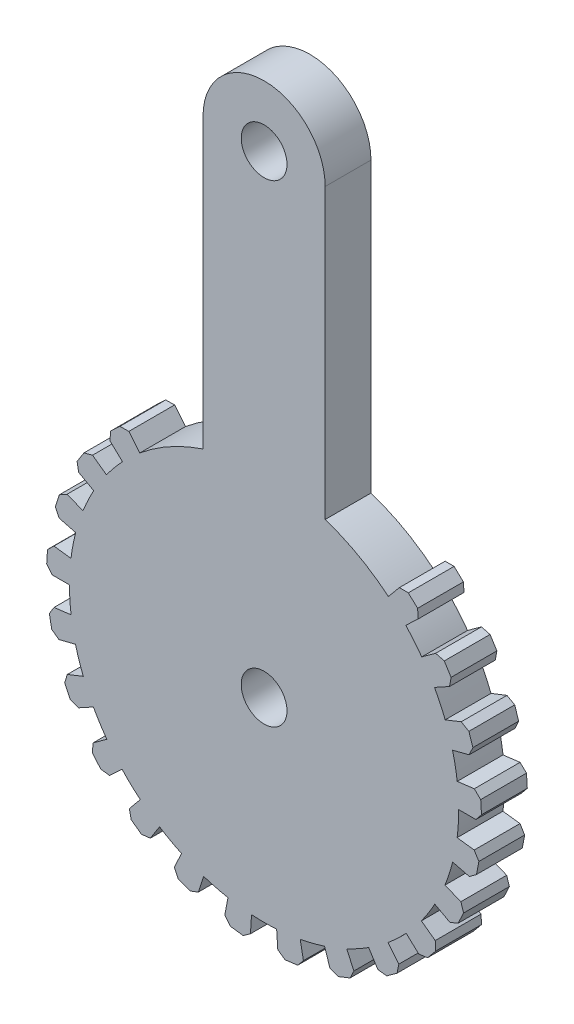
from build123d import *

# Parameters (mm, degrees)
SKETCH1_R           = 1.5
BOSS_EXTRUDE2_DEPTH = 3


with BuildPart() as part:
    # Sketch1 → Boss-Extrude2 (new body)
    with BuildSketch(Plane.XY):
        with BuildLine():
            Line((-4, 31), (-4, 12.106300013))
            ThreePointArc((-4, 12.106300013), (-4.733275563, 11.838859846), (-5.448812758, 11.527052508))
            ThreePointArc((-5.448812758, 11.527052508), (-6.142359345, 11.172910171), (-6.812992455, 10.777088374))
            ThreePointArc((-6.812992455, 10.777088374), (-7.494261967, 10.314966678), (-8.144289673, 9.809844327))
            Line((-8.144289673, 9.809844327), (-8.862903468, 10.675418826))
            Line((-8.862903468, 10.675418826), (-9.445525531, 10.669796035))
            Line((-9.445525531, 10.669796035), (-10.055652175, 10.096848981))
            Line((-10.055652175, 10.096848981), (-10.097847012, 9.515729647))
            Line((-10.097847012, 9.515729647), (-9.27910266, 8.744184))
            ThreePointArc((-9.27910266, 8.744184), (-9.824043845, 8.127155869), (-10.328030916, 7.476247548))
            Line((-10.328030916, 7.476247548), (-11.239327761, 8.13591645))
            Line((-11.239327761, 8.13591645), (-11.80224735, 7.985578094))
            Line((-11.80224735, 7.985578094), (-12.250719604, 7.278898898))
            Line((-12.250719604, 7.278898898), (-12.147070312, 6.705543068))
            Line((-12.147070312, 6.705543068), (-11.162172719, 6.161850387))
            ThreePointArc((-11.162172719, 6.161850387), (-11.536544919, 5.428685967), (-11.862823992, 4.672890641))
            Line((-11.862823992, 4.672890641), (-12.909543756, 5.085204521))
            Line((-12.909543756, 5.085204521), (-13.417390562, 4.799596912))
            Line((-13.417390562, 4.799596912), (-13.676029266, 4.003588828))
            Line((-13.676029266, 4.003588828), (-13.43304851, 3.474022556))
            Line((-13.43304851, 3.474022556), (-12.343882415, 3.192345052))
            ThreePointArc((-12.343882415, 3.192345052), (-12.524162447, 2.389111761), (-12.652232208, 1.575918828))
            Line((-12.652232208, 1.575918828), (-13.768605638, 1.71497049))
            Line((-13.768605638, 1.71497049), (-14.189469779, 1.312039404))
            Line((-14.189469779, 1.312039404), (-14.242023712, 0.476718548))
            Line((-14.242023712, 0.476718548), (-13.874978867, 0.024216431))
            Line((-13.874978867, 0.024216431), (-12.749980581, 0.022252937))
            ThreePointArc((-12.749980581, 0.022252937), (-12.724840787, -0.800579124), (-12.646654143, -1.62007376))
            Line((-12.646654143, -1.62007376), (-13.762535391, -1.763021444))
            Line((-13.762535391, -1.763021444), (-14.069972424, -2.257958364))
            Line((-14.069972424, -2.257958364), (-13.91313943, -3.080105712))
            Line((-13.91313943, -3.080105712), (-13.445093273, -3.427111302))
            Line((-13.445093273, -3.427111302), (-12.354950575, -3.149237412))
            ThreePointArc((-12.354950575, -3.149237412), (-12.125970583, -3.939966678), (-11.846440287, -4.714271155))
            Line((-11.846440287, -4.714271155), (-12.89171443, -5.130236257))
            Line((-12.89171443, -5.130236257), (-13.066406957, -5.686080305))
            Line((-13.066406957, -5.686080305), (-12.710041429, -6.443395602))
            Line((-12.710041429, -6.443395602), (-12.170403021, -6.663101027))
            Line((-12.170403021, -6.663101027), (-11.183613587, -6.122849592))
            ThreePointArc((-11.183613587, -6.122849592), (-10.76518105, -6.831791636), (-10.30187102, -7.512253556))
            Line((-10.30187102, -7.512253556), (-11.210859639, -8.175099458))
            Line((-11.210859639, -8.175099458), (-11.241831085, -8.756924908))
            Line((-11.241831085, -8.756924908), (-10.70832478, -9.401823249))
            Line((-10.70832478, -9.401823249), (-10.131001588, -9.48042361))
            Line((-10.131001588, -9.48042361), (-9.309569027, -8.711740614))
            ThreePointArc((-9.309569027, -8.711740614), (-8.727975601, -9.29435), (-8.109997309, -9.838213438))
            Line((-8.109997309, -9.838213438), (-8.825585306, -10.706291095))
            Line((-8.825585306, -10.706291095), (-8.710889622, -11.277539713))
            Line((-8.710889622, -11.277539713), (-8.033764703, -11.769499764))
            Line((-8.033764703, -11.769499764), (-7.455032066, -11.702056311))
            Line((-7.455032066, -11.702056311), (-6.850570006, -10.753240934))
            ThreePointArc((-6.850570006, -10.753240934), (-6.142359345, -11.172910171), (-5.40854264, -11.546002187))
            Line((-5.40854264, -11.546002187), (-5.885766991, -12.564767086))
            Line((-5.885766991, -12.564767086), (-5.632610928, -13.089545223))
            Line((-5.632610928, -13.089545223), (-4.854413643, -13.397655324))
            Line((-4.854413643, -13.397655324), (-4.310635461, -13.188405776))
            Line((-4.310635461, -13.188405776), (-3.961124478, -12.119075578))
            ThreePointArc((-3.961124478, -12.119075578), (-3.170796061, -12.349435304), (-2.367249346, -12.528313156))
            Line((-2.367249346, -12.528313156), (-2.576124288, -13.633752552))
            Line((-2.576124288, -13.633752552), (-2.200414573, -14.079086466))
            Line((-2.200414573, -14.079086466), (-1.370041921, -14.183986927))
            Line((-1.370041921, -14.183986927), (-0.895385777, -13.846079204))
            Line((-0.895385777, -13.846079204), (-0.82278693, -12.723424133))
            ThreePointArc((-0.82278693, -12.723424133), (0, -12.75), (0.82278693, -12.723424133))
            Line((0.82278693, -12.723424133), (0.895385777, -13.846079204))
            Line((0.895385777, -13.846079204), (1.370041921, -14.183986927))
            Line((1.370041921, -14.183986927), (2.200414573, -14.079086466))
            Line((2.200414573, -14.079086466), (2.576124288, -13.633752552))
            Line((2.576124288, -13.633752552), (2.367249346, -12.528313156))
            ThreePointArc((2.367249346, -12.528313156), (3.170796061, -12.349435304), (3.961124478, -12.119075578))
            Line((3.961124478, -12.119075578), (4.310635461, -13.188405776))
            Line((4.310635461, -13.188405776), (4.854413643, -13.397655324))
            Line((4.854413643, -13.397655324), (5.632610928, -13.089545223))
            Line((5.632610928, -13.089545223), (5.885766991, -12.564767086))
            Line((5.885766991, -12.564767086), (5.40854264, -11.546002187))
            ThreePointArc((5.40854264, -11.546002187), (6.142359345, -11.172910171), (6.850570006, -10.753240934))
            Line((6.850570006, -10.753240934), (7.455032066, -11.702056311))
            Line((7.455032066, -11.702056311), (8.033764703, -11.769499764))
            Line((8.033764703, -11.769499764), (8.710889622, -11.277539713))
            Line((8.710889622, -11.277539713), (8.825585306, -10.706291095))
            Line((8.825585306, -10.706291095), (8.109997309, -9.838213438))
            ThreePointArc((8.109997309, -9.838213438), (8.727975601, -9.29435), (9.309569027, -8.711740614))
            Line((9.309569027, -8.711740614), (10.131001588, -9.48042361))
            Line((10.131001588, -9.48042361), (10.70832478, -9.401823249))
            Line((10.70832478, -9.401823249), (11.241831085, -8.756924908))
            Line((11.241831085, -8.756924908), (11.210859639, -8.175099458))
            Line((11.210859639, -8.175099458), (10.30187102, -7.512253556))
            ThreePointArc((10.30187102, -7.512253556), (10.76518105, -6.831791636), (11.183613587, -6.122849592))
            Line((11.183613587, -6.122849592), (12.170403021, -6.663101027))
            Line((12.170403021, -6.663101027), (12.710041429, -6.443395602))
            Line((12.710041429, -6.443395602), (13.066406957, -5.686080305))
            Line((13.066406957, -5.686080305), (12.89171443, -5.130236257))
            Line((12.89171443, -5.130236257), (11.846440287, -4.714271155))
            ThreePointArc((11.846440287, -4.714271155), (12.125970583, -3.939966678), (12.354950575, -3.149237412))
            Line((12.354950575, -3.149237412), (13.445093273, -3.427111302))
            Line((13.445093273, -3.427111302), (13.91313943, -3.080105712))
            Line((13.91313943, -3.080105712), (14.069972424, -2.257958364))
            Line((14.069972424, -2.257958364), (13.762535391, -1.763021444))
            Line((13.762535391, -1.763021444), (12.646654143, -1.62007376))
            ThreePointArc((12.646654143, -1.62007376), (12.724840787, -0.800579124), (12.749980581, 0.022252937))
            Line((12.749980581, 0.022252937), (13.874978867, 0.024216431))
            Line((13.874978867, 0.024216431), (14.242023712, 0.476718548))
            Line((14.242023712, 0.476718548), (14.189469779, 1.312039404))
            Line((14.189469779, 1.312039404), (13.768605638, 1.71497049))
            Line((13.768605638, 1.71497049), (12.652232208, 1.575918828))
            ThreePointArc((12.652232208, 1.575918828), (12.524162447, 2.389111761), (12.343882415, 3.192345052))
            Line((12.343882415, 3.192345052), (13.43304851, 3.474022556))
            Line((13.43304851, 3.474022556), (13.676029266, 4.003588828))
            Line((13.676029266, 4.003588828), (13.417390562, 4.799596912))
            Line((13.417390562, 4.799596912), (12.909543756, 5.085204521))
            Line((12.909543756, 5.085204521), (11.862823992, 4.672890641))
            ThreePointArc((11.862823992, 4.672890641), (11.536544919, 5.428685967), (11.162172719, 6.161850387))
            Line((11.162172719, 6.161850387), (12.147070312, 6.705543068))
            Line((12.147070312, 6.705543068), (12.250719604, 7.278898898))
            Line((12.250719604, 7.278898898), (11.80224735, 7.985578094))
            Line((11.80224735, 7.985578094), (11.239327761, 8.13591645))
            Line((11.239327761, 8.13591645), (10.328030916, 7.476247548))
            ThreePointArc((10.328030916, 7.476247548), (9.824043845, 8.127155869), (9.27910266, 8.744184))
            Line((9.27910266, 8.744184), (10.097847012, 9.515729647))
            Line((10.097847012, 9.515729647), (10.055652175, 10.096848981))
            Line((10.055652175, 10.096848981), (9.445525531, 10.669796035))
            Line((9.445525531, 10.669796035), (8.862903468, 10.675418826))
            Line((8.862903468, 10.675418826), (8.144289673, 9.809844327))
            ThreePointArc((8.144289673, 9.809844327), (7.494261967, 10.314966678), (6.812992455, 10.777088374))
            ThreePointArc((6.812992455, 10.777088374), (6.142359345, 11.172910171), (5.448812758, 11.527052508))
            ThreePointArc((5.448812758, 11.527052508), (4.733275563, 11.838859846), (4, 12.106300013))
            Line((4, 12.106300013), (4, 31))
            ThreePointArc((4, 31), (0, 35), (-4, 31))
        make_face()
        Circle(SKETCH1_R, mode=Mode.SUBTRACT)
        with Locations((0, 31)):
            Circle(SKETCH1_R, mode=Mode.SUBTRACT)
    extrude(amount=BOSS_EXTRUDE2_DEPTH)


solid = part.part
